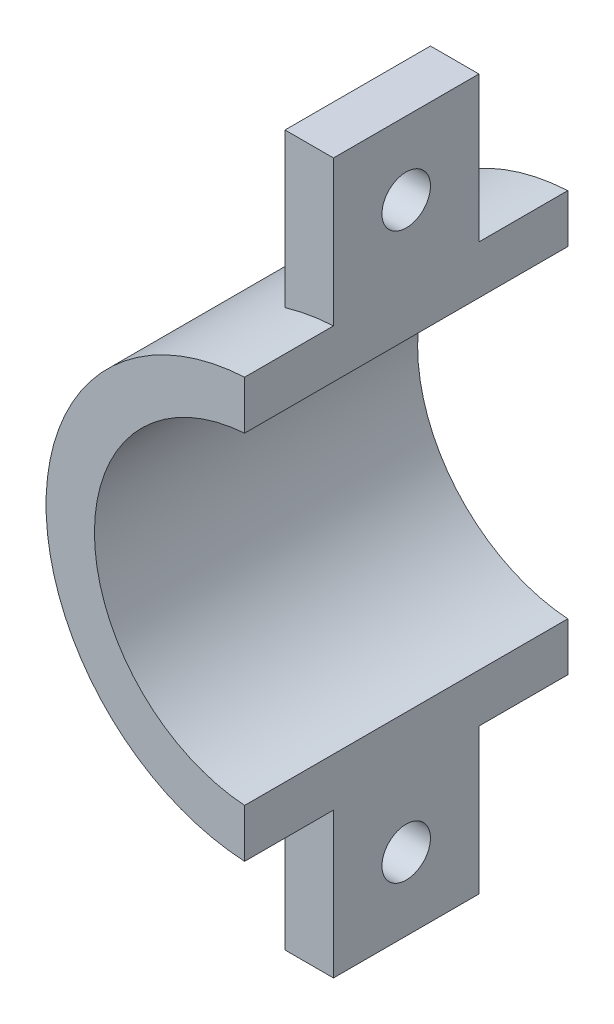
from build123d import *

# Parameters (mm, degrees)
EXTRUDE_1_DEPTH = 20
SKETCH_3_R      = 1.5
EXTRUDE_2_DEPTH = 3


with BuildPart() as part:
    # Эскиз1 → Бобышка-Вытянуть1 (new body)
    with BuildSketch(Plane.XY):
        with BuildLine():
            Line((-0.706664701, 9.975), (-0.706664701, 12.975))
            ThreePointArc((-0.706664701, 12.975), (-12.994229489, 0), (-0.706664701, -12.975))
            Line((-0.706664701, -12.975), (-0.706664701, -9.975))
            ThreePointArc((-0.706664701, -9.975), (-10, 0), (-0.706664701, 9.975))
        make_face()
    extrude(amount=EXTRUDE_1_DEPTH)

    # Эскиз3 → Бобышка-Вытянуть2 (add)
    # profile 1 of 2: a face of its own
    with BuildSketch(Plane(origin=(-0.706664701, 0, 0), x_dir=(0, 0, -1), z_dir=(1, 0, 0))):
        Polygon((-10, 9.975), (-14.5, 9.975), (-14.5, 21.975), (-5.5, 21.975), (-5.5, 9.975), align=None)
        with Locations((-10, 17.475)):
            Circle(SKETCH_3_R, mode=Mode.SUBTRACT)
    # profile 2 of 2: a face of its own
    with BuildSketch(Plane(origin=(-0.706664701, 0, 0), x_dir=(0, 0, -1), z_dir=(1, 0, 0))):
        Polygon((-10, -9.975), (-14.5, -9.975), (-14.5, -21.975), (-5.5, -21.975), (-5.5, -9.975), align=None)
        with Locations((-10, -17.475)):
            Circle(SKETCH_3_R, mode=Mode.SUBTRACT)
    extrude(amount=-EXTRUDE_2_DEPTH)


solid = part.part
